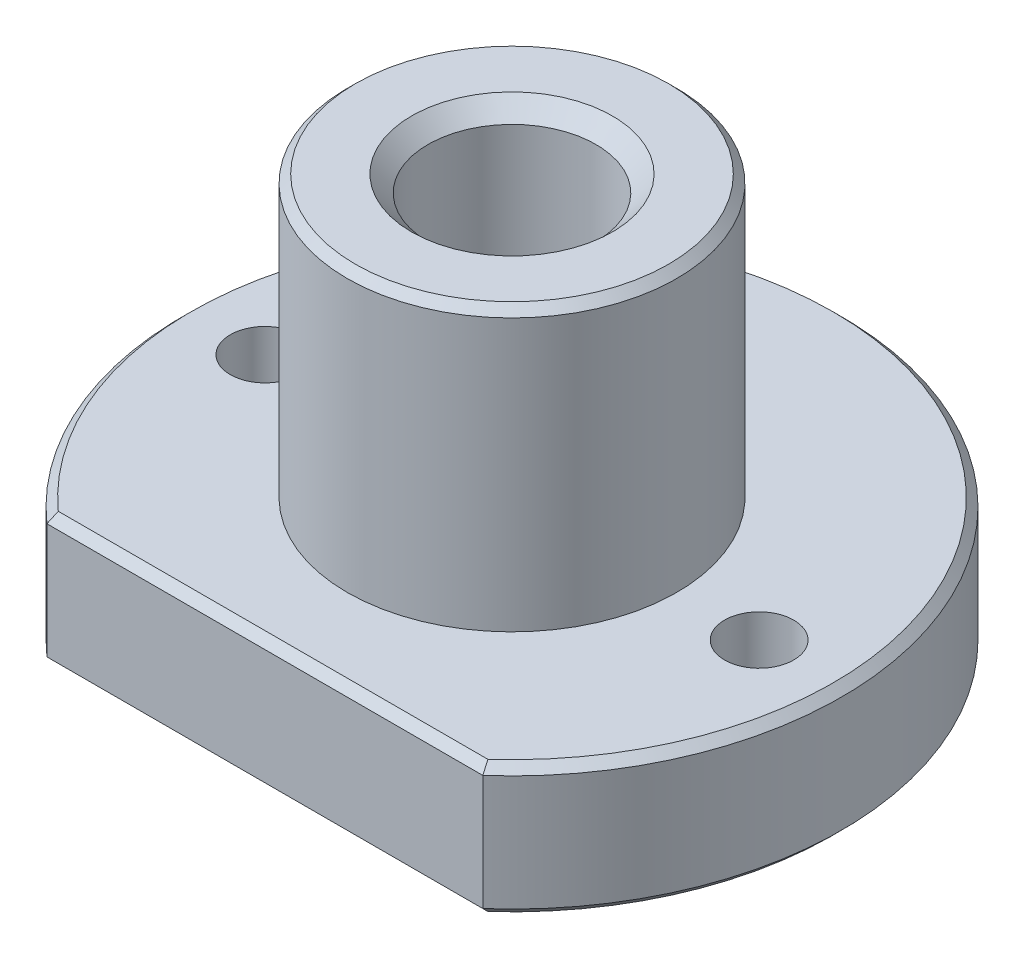
from build123d import *

# Parameters (mm, degrees)
SKETCH1_R           = 20
BOSS_EXTRUDE1_DEPTH = 8
SKETCH2_R           = 10
BOSS_EXTRUDE2_DEPTH = 17
M12_TAPPED_HOLE1_D  = 10.2
CHAMFER1_SIZE       = 1
M5_TAPPED_HOLE1_D   = 4.2
CUT_EXTRUDE1_REACH  = 39.749
SKETCH7_W           = 49.327328333
SKETCH7_H           = 13.526029649
CHAMFER2_SIZE       = 0.5


with BuildPart() as part:
    # Sketch1 → Boss-Extrude1 (new body)
    with BuildSketch(Plane(origin=(0, 0, 0), x_dir=(1, 0, 0), z_dir=(0, 1, 0))):
        with Locations(Location((0, 0, 0), (0, 0, 270))):
            Circle(SKETCH1_R)
    extrude(amount=BOSS_EXTRUDE1_DEPTH)

    # Sketch2 → Boss-Extrude2 (add)
    with BuildSketch(Plane(origin=(0, 8, 0), x_dir=(1, 0, 0), z_dir=(0, 1, 0))):
        with Locations(Location((0, 0, 0), (0, 0, 270))):
            Circle(SKETCH2_R)
    extrude(amount=BOSS_EXTRUDE2_DEPTH)

    # M12 Tapped Hole1 (through all)
    with Locations(Plane(origin=(0, 25, 0), x_dir=(-1, 0, 0), z_dir=(0, 1, 0))):
        with Locations((0, 0)):
            Hole(M12_TAPPED_HOLE1_D / 2)

    # Chamfer1
    chamfer1_edges = [part.edges().sort_by_distance(p)[0] for p in [
        (-5.1, 25, 0),
        (-5.1, 0, 0),
    ]]
    chamfer(chamfer1_edges, length=CHAMFER1_SIZE)

    # M5 Tapped Hole1 (through all)
    with Locations(Plane(origin=(0, 8, 0), x_dir=(-1, 0, 0), z_dir=(0, 1, 0))):
        with Locations((15, 0), (-15, 0)):
            Hole(M5_TAPPED_HOLE1_D / 2)

    # Sketch7 → Cut-Extrude1 (cut, up to next)
    with BuildSketch(Plane.XZ, mode=Mode.PRIVATE) as cut_extrude1_sk1:
        with Locations((2.087303486, 21.763014825)):
            Rectangle(SKETCH7_W, SKETCH7_H)
    cut_extrude1_tool1 = extrude(cut_extrude1_sk1.sketch, amount=-CUT_EXTRUDE1_REACH, mode=Mode.PRIVATE) & part.part
    add(cut_extrude1_tool1.solids().sort_by_distance((2.087303, 0, 21.763015))[0], mode=Mode.SUBTRACT)

    # Chamfer2
    chamfer2_edges = [part.edges().sort_by_distance(p)[0] for p in [
        (0, 0, -20),
        (0, 8, 15),
        (0, 0, 15),
        (0, 8, -20),
        (0, 25, -10),
    ]]
    chamfer(chamfer2_edges, length=CHAMFER2_SIZE)


solid = part.part
